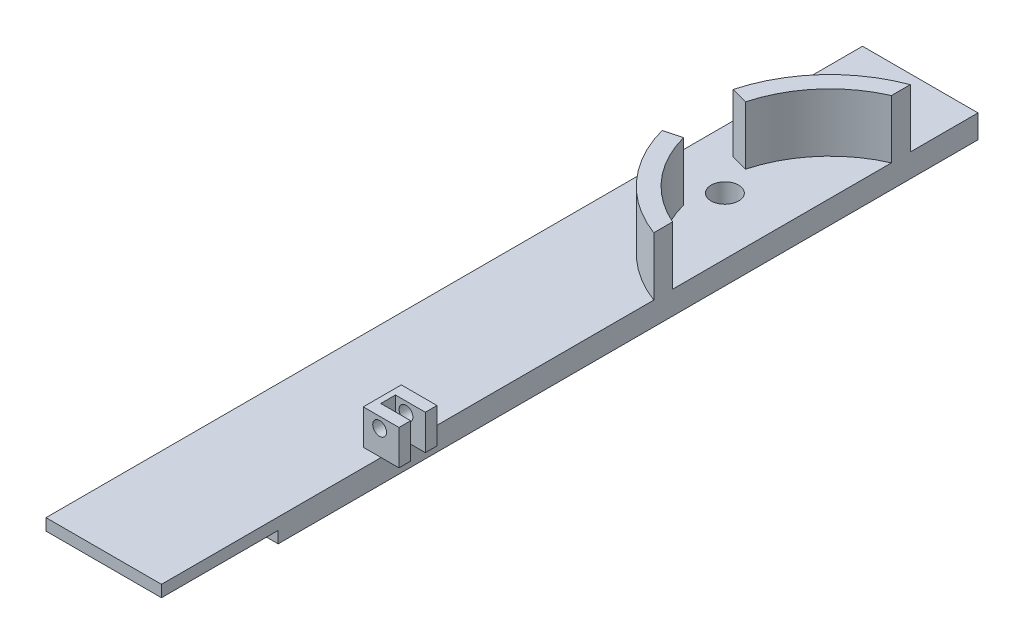
from build123d import *

# Parameters (mm, degrees)
SKETCH2_W           = 25.146
SKETCH2_H           = 177.8
BOSS_EXTRUDE1_DEPTH = 5.08
SKETCH4_W           = 25.146
SKETCH4_H           = 25.4
CUT_EXTRUDE2_DEPTH  = 2.54
BOSS_EXTRUDE2_DEPTH = 12.7
SKETCH6_R           = 3
CUT_EXTRUDE3_DEPTH  = 146.707735218
BOSS_EXTRUDE3_DEPTH = 7.62
SKETCH9_R           = 1.5
CUT_EXTRUDE4_DEPTH  = 10.668


with BuildPart() as part:
    # Sketch2 → Boss-Extrude1 (new body)
    with BuildSketch(Plane(origin=(0, 0, 0), x_dir=(1, 0, 0), z_dir=(0, 1, 0))):
        with Locations((1.939834286, -54.988822857)):
            Rectangle(SKETCH2_W, SKETCH2_H)
    extrude(amount=BOSS_EXTRUDE1_DEPTH)

    # Sketch4 → Cut-Extrude2 (cut)
    with BuildSketch(Plane.XZ):
        with Locations((1.939834286, 131.188822857)):
            Rectangle(SKETCH4_W, SKETCH4_H)
    extrude(amount=-CUT_EXTRUDE2_DEPTH, mode=Mode.SUBTRACT)

    # Sketch5 → Boss-Extrude2 (add)
    with BuildSketch(Plane(origin=(0, 5.08, 0), x_dir=(1, 0, 0), z_dir=(0, 1, 0))):
        with BuildLine():
            Line((14.512834286, 19.170963767), (14.512834286, 15.062455759))
            ThreePointArc((14.512834286, 15.062455759), (5.213589162, 8.191698096), (-0.187237198, -2.031527684))
            Line((-0.187237198, -2.031527684), (-3.867414596, -1.045427123))
            ThreePointArc((-3.867414596, -1.045427123), (2.870150259, 11.292575602), (14.512834286, 19.170963767))
        make_face()
        with BuildLine():
            Line((14.512834286, -32.584101473), (14.512834286, -36.692609481))
            ThreePointArc((14.512834286, -36.692609481), (2.870150259, -28.814221316), (-3.867414596, -16.476218592))
            Line((-3.867414596, -16.476218592), (-0.187237198, -15.49011803))
            ThreePointArc((-0.187237198, -15.49011803), (5.213589162, -25.713343811), (14.512834286, -32.584101473))
        make_face()
    extrude(amount=BOSS_EXTRUDE2_DEPTH)

    # Sketch6 → Cut-Extrude3 (cut, through all)
    with BuildSketch(Plane.XZ):
        with Locations(Location((2.066834286, 8.760822857, 0), (0, 0, 270))):
            Circle(SKETCH6_R)
    extrude(amount=-CUT_EXTRUDE3_DEPTH, mode=Mode.SUBTRACT)

    # Sketch8 → Boss-Extrude3 (add)
    with BuildSketch(Plane(origin=(0, 5.08, 0), x_dir=(1, 0, 0), z_dir=(0, 1, 0))):
        Polygon((18.409653056, -90.331413744), (18.409653056, -87.791413744), (10.639653056, -87.791413744), (10.639653056, -96.071413744), (18.409653056, -96.071413744), (18.409653056, -93.531413744), (11.909653056, -93.531413744), (11.909653056, -90.331413744), align=None)
    extrude(amount=BOSS_EXTRUDE3_DEPTH)

    # Sketch9 → Cut-Extrude4 (cut)
    with BuildSketch(Plane.XY.offset(96.071413744)):
        with Locations((14.195653056, 10.414)):
            Circle(SKETCH9_R)
    extrude(amount=-CUT_EXTRUDE4_DEPTH, mode=Mode.SUBTRACT)


solid = part.part
